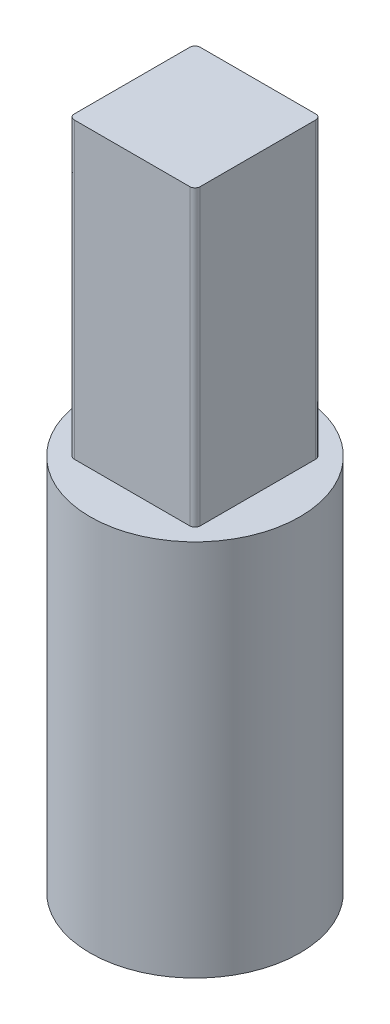
from build123d import *

# Parameters (mm, degrees)
SKETCH1_W           = 152.4
SKETCH1_H           = 152.4
BOSS_EXTRUDE1_DEPTH = 355.6
FILLET1_R           = 6.35
SKETCH2_R           = 127
BOSS_EXTRUDE2_DEPTH = 457.2


with BuildPart() as part:
    # Sketch1 → Boss-Extrude1 (new body)
    with BuildSketch(Plane(origin=(0, 0, 0), x_dir=(1, 0, 0), z_dir=(0, 1, 0))):
        Rectangle(SKETCH1_W, SKETCH1_H)
    extrude(amount=BOSS_EXTRUDE1_DEPTH)

    # Fillet1
    fillet1_edges = [part.edges().sort_by_distance(p)[0] for p in [
        (-76.2, 177.8, -76.2),
        (76.2, 177.8, -76.2),
        (76.2, 177.8, 76.2),
        (-76.2, 177.8, 76.2),
    ]]
    fillet(fillet1_edges, radius=FILLET1_R)

    # Sketch2 → Boss-Extrude2 (add)
    with BuildSketch(Plane(origin=(0, 0, 0), x_dir=(-1, 0, 0), z_dir=(0, -1, 0))):
        with Locations(Location((0, 0, 0), (0, 0, 90))):
            Circle(SKETCH2_R)
    extrude(amount=BOSS_EXTRUDE2_DEPTH)


solid = part.part
